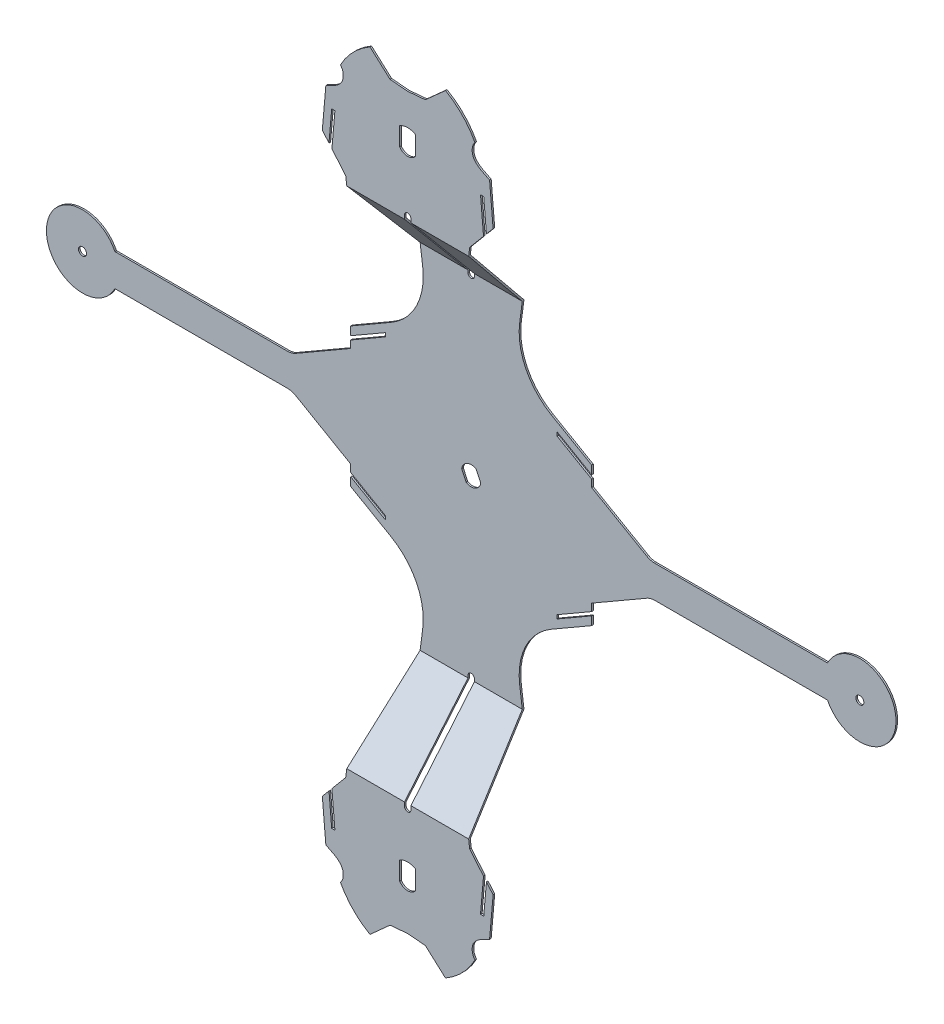
from build123d import *

# Parameters (mm, degrees)
SALIENTE_EXTRUIR1_DEPTH     = 271
CORTAR_EXTRUIR9_DEPTH       = 372.904084134
CORTAR_EXTRUIR9_DEPTH_BACK  = 372.904084134
CROQUIS4_R                  = 2.5
CORTAR_EXTRUIR10_DEPTH      = 372.904084134
CORTAR_EXTRUIR10_DEPTH_BACK = 372.904084134
CROQUIS2_W                  = 600.899293422
CROQUIS2_H                  = 554.061756016
REDONDEO1_R                 = 40
REDONDEO2_R                 = 10


with BuildPart() as part:
    # Croquis1 → Saliente-Extruir1 (new, symmetric)
    with BuildSketch(Plane(origin=(0, 0, 0), x_dir=(0, 0, -1), z_dir=(1, 0, 0))):
        Polygon((-18.5, -110), (-18.5, 110), (-58.031437996, 157.111733252), (-58.031437996, 248), (-57.031437996, 248), (-57.031437996, 157.475703486), (-17.5, 110.363970234), (-17.5, -110.363970234), (-57.031437996, -157.475703486), (-57.031437996, -248), (-58.031437996, -248), (-58.031437996, -157.111733252), align=None)
    extrude(amount=SALIENTE_EXTRUIR1_DEPTH, both=True)

    # Croquis4 → Cortar-Extruir9 (cut, two sides: drawn at the far end of the back side and taken through both)
    with BuildSketch(Plane.XY.offset(-CORTAR_EXTRUIR9_DEPTH_BACK)):
        with Locations(Location((-242, 0, 0), (0, 0, 90))):
            Circle(CROQUIS4_R)
        with Locations(Location((242, 0, 0), (0, 0, 90))):
            Circle(CROQUIS4_R)
        with BuildLine():
            Line((-5, 201.31662479), (-5, 194.68337521))
            ThreePointArc((-5, 194.68337521), (0, 192), (5, 194.68337521))
            Line((5, 194.68337521), (5, 201.31662479))
            Line((5, 201.31662479), (5, 206.077747211))
            ThreePointArc((5, 206.077747211), (0, 207.5), (-5, 206.077747211))
            Line((-5, 206.077747211), (-5, 201.31662479))
        make_face()
        with BuildLine():
            Line((5, -201.31662479), (5, -194.68337521))
            Line((5, -194.68337521), (5, -189.922252789))
            ThreePointArc((5, -189.922252789), (0, -188.5), (-5, -189.922252789))
            Line((-5, -189.922252789), (-5, -194.68337521))
            Line((-5, -194.68337521), (-5, -201.31662479))
            ThreePointArc((-5, -201.31662479), (0, -204), (5, -201.31662479))
        make_face()
        with BuildLine():
            Line((-5.933205139, 0.892791565), (-3.129872731, -5.118974183))
            ThreePointArc((-3.129872731, -5.118974183), (2.53570957, -5.437846722), (5.933205139, -0.892791565))
            Line((5.933205139, -0.892791565), (3.129872731, 5.118974183))
            ThreePointArc((3.129872731, 5.118974183), (-2.53570957, 5.437846722), (-5.933205139, 0.892791565))
        make_face()
    extrude(amount=CORTAR_EXTRUIR9_DEPTH + CORTAR_EXTRUIR9_DEPTH_BACK, mode=Mode.SUBTRACT)

    # Croquis2 → Cortar-Extruir10 (cut, two sides: drawn at the far end of the back side and taken through both)
    # profile 1 of 3: a face of its own
    with BuildSketch(Plane.XY.offset(-CORTAR_EXTRUIR10_DEPTH_BACK)):
        Rectangle(CROQUIS2_W, CROQUIS2_H)
        with BuildLine():
            Line((-53.168424061, 179.61105261), (-50.970090866, 204.738116011))
            add(Edge.make_bspline(
                [(-50.970090866, 204.738116011), (-47.792962615, 206.268732201), (-40.787060156, 209.02456014), (-39.883059345, 216.418425991), (-40.736802152, 219.176084752), (-41.896759663, 220.381052918)],
                knots=[0, 0, 0, 0, 0.610720728, 0.773572895, 1, 1, 1, 1], degree=3))
            ThreePointArc((-41.896759663, 220.381052918), (-34.036336447, 231.13273006), (-23.5, 239.279534881))
            Line((-23.5, 239.279534881), (-11, 228.04191018))
            Line((-11, 228.04191018), (0, 227.079534881))
            Line((0, 227.079534881), (11, 228.04191018))
            Line((11, 228.04191018), (23.5, 239.279534881))
            ThreePointArc((23.5, 239.279534881), (34.036336447, 231.13273006), (41.896759663, 220.381052918))
            add(Edge.make_bspline(
                [(50.970090866, 204.738116011), (47.792962615, 206.268732201), (40.787060156, 209.02456014), (39.883059345, 216.418425991), (40.736802152, 219.176084752), (41.896759663, 220.381052918)],
                knots=[0, 0, 0, 0, 0.610720728, 0.773572895, 1, 1, 1, 1], degree=3))
            Line((50.970090866, 204.738116011), (53.168424061, 179.61105261))
            Line((53.168424061, 179.61105261), (49.023071172, 174.670813412))
            Line((49.023071172, 174.670813412), (47.331626671, 194.00411253))
            Line((47.331626671, 194.00411253), (45.323986996, 194.00411253))
            Line((45.323986996, 194.00411253), (47.204993262, 172.50411253))
            Line((47.204993262, 172.50411253), (38.602496631, 162.252056265))
            Line((38.602496631, 162.252056265), (26.75, 71.158420678))
            Line((26.75, 71.158420678), (75, 43.301270189))
            Line((75, 43.301270189), (75, 38.035835734))
            Line((75, 38.035835734), (53.5, 50.448866522))
            Line((53.5, 50.448866522), (53.5, 48.139465445))
            Line((53.5, 48.139465445), (75, 35.726434657))
            Line((75, 35.726434657), (75, 31.166434657))
            Line((75, 31.166434657), (111.661340242, 10))
            Line((111.661340242, 10), (221.844355629, 10))
            ThreePointArc((221.844355629, 10), (264.5, 0), (221.844355629, -10))
            Line((221.844355629, -10), (111.661340242, -10))
            Line((111.661340242, -10), (75, -31.166434657))
            Line((75, -31.166434657), (75, -35.726434657))
            Line((75, -35.726434657), (53.5, -48.139465445))
            Line((53.5, -48.139465445), (53.5, -50.448866522))
            Line((53.5, -50.448866522), (75, -38.035835734))
            Line((75, -38.035835734), (75, -43.301270189))
            Line((75, -43.301270189), (26.75, -71.158420678))
            Line((26.75, -71.158420678), (38.602496631, -162.252056265))
            Line((38.602496631, -162.252056265), (47.204993262, -172.50411253))
            Line((47.204993262, -172.50411253), (45.323986996, -194.00411253))
            Line((45.323986996, -194.00411253), (47.331626671, -194.00411253))
            Line((47.331626671, -194.00411253), (49.023071172, -174.670813412))
            Line((49.023071172, -174.670813412), (53.168424061, -179.61105261))
            Line((53.168424061, -179.61105261), (50.970090866, -204.738116011))
            add(Edge.make_bspline(
                [(50.970090866, -204.738116011), (47.792962615, -206.268732201), (40.787060156, -209.02456014), (39.883059345, -216.418425991), (40.736802152, -219.176084752), (41.896759663, -220.381052918)],
                knots=[0, 0, 0, 0, 0.610720728, 0.773572895, 1, 1, 1, 1], degree=3))
            ThreePointArc((41.896759663, -220.381052918), (34.036336447, -231.13273006), (23.5, -239.279534881))
            Line((23.5, -239.279534881), (11, -228.04191018))
            Line((11, -228.04191018), (0, -227.079534881))
            Line((0, -227.079534881), (-11, -228.04191018))
            Line((-11, -228.04191018), (-23.5, -239.279534881))
            ThreePointArc((-23.5, -239.279534881), (-34.036336447, -231.13273006), (-41.896759663, -220.381052918))
            add(Edge.make_bspline(
                [(-50.970090866, -204.738116011), (-47.792962615, -206.268732201), (-40.787060156, -209.02456014), (-39.883059345, -216.418425991), (-40.736802152, -219.176084752), (-41.896759663, -220.381052918)],
                knots=[0, 0, 0, 0, 0.610720728, 0.773572895, 1, 1, 1, 1], degree=3))
            Line((-50.970090866, -204.738116011), (-53.168424061, -179.61105261))
            Line((-53.168424061, -179.61105261), (-49.023071172, -174.670813412))
            Line((-49.023071172, -174.670813412), (-47.331626671, -194.00411253))
            Line((-47.331626671, -194.00411253), (-45.323986996, -194.00411253))
            Line((-45.323986996, -194.00411253), (-47.204993262, -172.50411253))
            Line((-47.204993262, -172.50411253), (-38.602496631, -162.252056265))
            Line((-38.602496631, -162.252056265), (-26.75, -71.158420678))
            Line((-26.75, -71.158420678), (-75, -43.301270189))
            Line((-75, -43.301270189), (-75, -38.035835734))
            Line((-75, -38.035835734), (-53.5, -50.448866522))
            Line((-53.5, -50.448866522), (-53.5, -48.139465445))
            Line((-53.5, -48.139465445), (-75, -35.726434657))
            Line((-75, -35.726434657), (-75, -31.166434657))
            Line((-75, -31.166434657), (-111.661340242, -10))
            Line((-111.661340242, -10), (-221.844355629, -10))
            ThreePointArc((-221.844355629, -10), (-264.5, 0), (-221.844355629, 10))
            Line((-221.844355629, 10), (-111.661340242, 10))
            Line((-111.661340242, 10), (-75, 31.166434657))
            Line((-75, 31.166434657), (-75, 35.726434657))
            Line((-75, 35.726434657), (-53.5, 48.139465445))
            Line((-53.5, 48.139465445), (-53.5, 50.448866522))
            Line((-53.5, 50.448866522), (-75, 38.035835734))
            Line((-75, 38.035835734), (-75, 43.301270189))
            Line((-75, 43.301270189), (-26.75, 71.158420678))
            Line((-26.75, 71.158420678), (-38.602496631, 162.252056265))
            Line((-38.602496631, 162.252056265), (-47.204993262, 172.50411253))
            Line((-47.204993262, 172.50411253), (-45.323986996, 194.00411253))
            Line((-45.323986996, 194.00411253), (-47.331626671, 194.00411253))
            Line((-47.331626671, 194.00411253), (-49.023071172, 174.670813412))
            Line((-49.023071172, 174.670813412), (-53.168424061, 179.61105261))
        make_face(mode=Mode.SUBTRACT)
    # profile 2 of 3: a face of its own
    with BuildSketch(Plane.XY.offset(-CORTAR_EXTRUIR10_DEPTH_BACK)):
        with BuildLine():
            Line((-2, -108.5), (-2, -159.5))
            ThreePointArc((-2, -159.5), (0, -161.5), (2, -159.5))
            Line((2, -159.5), (2, -108.5))
            ThreePointArc((2, -108.5), (0, -106.5), (-2, -108.5))
        make_face()
    # profile 3 of 3: a face of its own
    with BuildSketch(Plane.XY.offset(-CORTAR_EXTRUIR10_DEPTH_BACK)):
        with BuildLine():
            Line((-2, 108.5), (-2, 159.5))
            ThreePointArc((-2, 159.5), (0, 161.5), (2, 159.5))
            Line((2, 159.5), (2, 108.5))
            ThreePointArc((2, 108.5), (0, 106.5), (-2, 108.5))
        make_face()
    extrude(amount=CORTAR_EXTRUIR10_DEPTH + CORTAR_EXTRUIR10_DEPTH_BACK, mode=Mode.SUBTRACT)

    # Redondeo1
    redondeo1_edges = [part.edges().sort_by_distance(p)[0] for p in [
        (26.75, 71.158420678, 18),
        (-26.75, -71.158420678, 18),
        (-26.75, 71.158420678, 18),
        (26.75, -71.158420678, 18),
    ]]
    fillet(redondeo1_edges, radius=REDONDEO1_R)

    # Redondeo2
    redondeo2_edges = [part.edges().sort_by_distance(p)[0] for p in [
        (111.661340242, 10, 18),
        (111.661340242, -10, 18),
        (-111.661340242, -10, 18),
        (-111.661340242, 10, 18),
    ]]
    fillet(redondeo2_edges, radius=REDONDEO2_R)


solid = part.part
